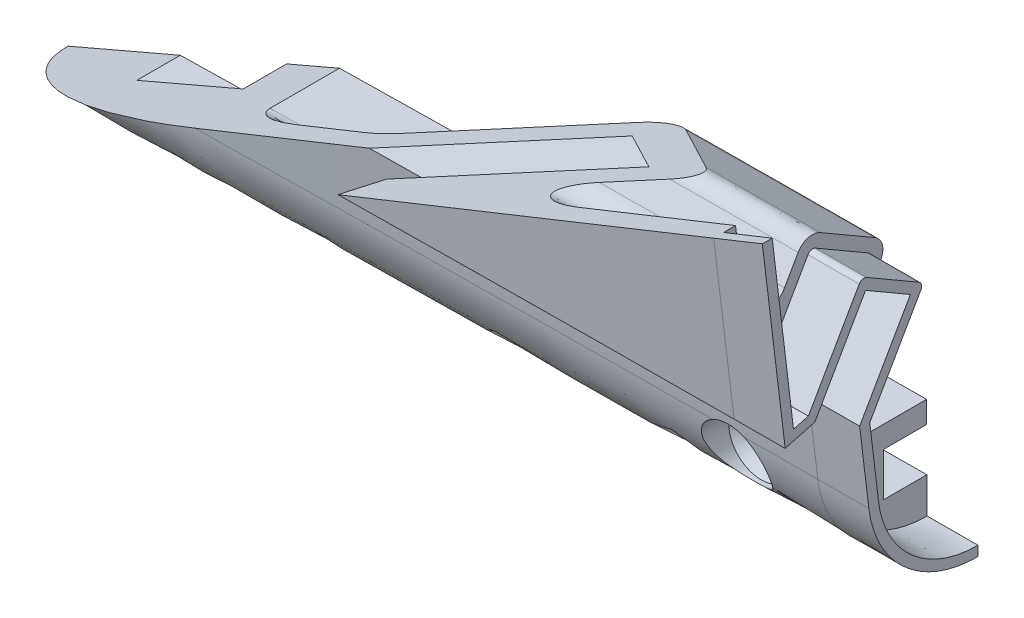
from build123d import *


with BuildPart() as part:
    # Sweep3: sweep along a path in Sketch3
    with BuildLine(Plane.XY.offset(101.6)) as sweep3_path:
        ThreePointArc((622.103936151, -83.199836272), (0, -43.636564626), (-622.103936151, -83.199836272))
    # Sketch4 → Sweep3 (sweep)
    with BuildSketch(Plane(origin=(-117.330566703, 4.430423936, 1117.6), x_dir=(0, 0, -1), z_dir=(0.9994536405585157, 0.03305178322465143, 0))):
        with BuildLine():
            Line((991.529482971, -5.453775083), (988.971801376, -5.453775083))
            Line((988.971801376, -5.453775083), (993.32506615, -42.283775083))
            Line((993.32506615, -42.283775083), (996.794703229, -41.354088728))
            Line((996.794703229, -41.354088728), (1002.763703229, -31.015013775))
            Line((1002.763703229, -31.015013775), (1007.999, -34.037749136))
            Line((1007.999, -34.037749136), (1002.03, -44.376824659))
            Line((1002.03, -44.376824659), (1003.077032208, -53.235049058))
            ThreePointArc((1003.077032208, -53.235049058), (1007.29752688, -61.276835992), (1015.8095, -64.443731312))
            Line((1015.8095, -64.443731312), (1015.8095, -59.12218153))
            Line((1015.8095, -59.12218153), (1010.7295, -59.12218153))
            Line((1010.7295, -59.12218153), (1010.7295, -54.041969025))
            Line((1010.7295, -54.041969025), (1015.8095, -54.041969025))
            Line((1015.8095, -54.041969025), (1015.8095, -51.501969025))
            Line((1015.8095, -51.501969025), (1007.687322123, -51.501969025))
            ThreePointArc((1007.687322123, -51.501969025), (1005.99997215, -50.860507955), (1005.164881483, -49.260118685))
            Line((1005.164881483, -49.260118685), (1004.750455768, -45.75394576))
            ThreePointArc((1004.750455768, -45.75394576), (1004.7850335, -44.943801809), (1005.073167189, -44.18583887))
            Line((1005.073167189, -44.18583887), (1010.516206197, -34.757795418))
            ThreePointArc((1010.516206197, -34.757795418), (1010.706497969, -33.312277166), (1009.818941274, -32.155567572))
            Line((1009.818941274, -32.155567572), (1003.483804566, -28.49781089))
            ThreePointArc((1003.483804566, -28.49781089), (1002.038222268, -28.307482122), (1000.881475684, -29.195102853))
            Line((1000.881475684, -29.195102853), (999.272416391, -31.982200293))
            ThreePointArc((999.272416391, -31.982200293), (996.560692883, -33.200105913), (994.550246564, -31.010392672))
            Line((994.550246564, -31.010392672), (991.529482971, -5.453775083))
        make_face()
    sweep(path=sweep3_path.line)

    # SurfaceCut1
    split(bisect_by=Plane(origin=(-211.442164364, -9.040193423, 0), x_dir=(0.04271589869142412, -0.9990872594518379, 0), z_dir=(-0.9990872594518379, -0.04271589869142412, 0)), keep=Keep.BOTTOM)

    # SurfaceCut2
    split(bisect_by=Plane(origin=(-22.670567211, -0.103737371, 0), x_dir=(-0.004575813400742646, 0.9999895309110599, 0), z_dir=(0.99998953091106, 0.004575813400742646, 0)), keep=Keep.BOTTOM)

    # Sketch8 → Cut-Revolve1 (revolve, cut)
    with BuildSketch(Plane(origin=(-117.056038996, -3.871025798, 0), x_dir=(0, 0, -1), z_dir=(0.9994536405585157, 0.03305178322465143, 0)), mode=Mode.PRIVATE) as cut_revolve1_sk:
        Polygon((-119.5705, -48.27608749), (-106.8705, -48.27608749), (-106.8705, -46.37108749), (-108.7755, -46.37108749), (-110.6805, -44.46608749), (-119.5705, -44.46608749), align=None)
    cut_revolve1 = revolve(cut_revolve1_sk.sketch.rotate(Axis((-115.460428217, -52.120737191, 119.5705), (0, 0, -1)), 91.894072645), axis=Axis((-115.460428217, -52.120737191, 119.5705), (0, 0, -1)), mode=Mode.SUBTRACT)

    # Sketch-Pattern1: Cut-Revolve1 at 2 more places
    with Locations((82.543476, 1.248991, 0), (-82.510753, -2.638363, 0)):
        add(cut_revolve1, mode=Mode.SUBTRACT)

    # Sweep4: sweep along a path in Sketch12
    with BuildLine(Plane(origin=(0, 0, 101.7905), x_dir=(-1, 0, 0), z_dir=(0, 0, -1))) as sweep4_path:
        ThreePointArc((22.461775047, -45.732778631), (19.477278647, -45.720029285), (16.492775047, -45.709094497))
    # Sketch11 → Sweep4 (sweep)
    with BuildSketch(Plane(origin=(-22.670567211, -0.103737371, 0), x_dir=(0, 0, -1), z_dir=(0.9999895309110599, 0.004575813400742645, 0))):
        with BuildLine():
            Line((-127.477241199, 0.416616241), (-123.294888708, -34.965832659))
            Line((-123.294888708, -34.965832659), (-121.558436986, -34.500572786))
            Line((-121.558436986, -34.500572786), (-115.572163807, -24.132043494))
            ThreePointArc((-115.572163807, -24.132043494), (-115.18658777, -23.836180594), (-114.704737676, -23.899617362))
            Line((-114.704737676, -23.899617362), (-108.589559095, -27.430217362))
            ThreePointArc((-108.589559095, -27.430217362), (-108.293696195, -27.8157934), (-108.357132963, -28.297643494))
            Line((-108.357132963, -28.297643494), (-114.390345193, -38.747473608))
            Line((-114.390345193, -38.747473608), (-113.38787021, -47.228347431))
            add(Edge.make_bspline(
                [(-113.38787021, -47.228347431), (-113.304795542, -47.931153716), (-113.005394664, -49.331088938), (-111.931567303, -51.921905104), (-109.715936846, -54.745328052), (-106.035083238, -56.946179963), (-103.201893406, -57.44100982), (-101.801323322, -57.427746915)],
                knots=[0, 0, 0, 0, 0.125, 0.25, 0.5, 0.75, 1, 1, 1, 1], degree=3))
            Line((-101.801323322, -57.427746915), (-101.7905, -57.427746915))
            Line((-101.7905, -57.427746915), (-101.7905, -58.570695669))
            add(Edge.make_bspline(
                [(-114.522967792, -47.362520754), (-114.477136038, -47.750254403), (-114.413580033, -48.134868747), (-114.251122313, -48.897876915), (-114.152305696, -49.275250489), (-113.807619255, -50.383084428), (-113.512952594, -51.094253598), (-112.794349261, -52.462021573), (-112.366195112, -53.121992394), (-111.411403795, -54.334514945), (-110.882225451, -54.893793968), (-110.009875034, -55.661414508), (-109.70425095, -55.906443165), (-109.076570448, -56.363840109), (-108.75418736, -56.576773283), (-107.762018779, -57.169401136), (-107.067422067, -57.503308187), (-105.974437358, -57.909885857), (-105.601773783, -58.029259911), (-104.85459633, -58.231444087), (-104.478193263, -58.315009286), (-103.340677537, -58.513974287), (-102.571330027, -58.578089855), (-101.7905, -58.570695669)],
                knots=[0, 0, 0, 0, 0.0625, 0.0625, 0.125, 0.125, 0.25, 0.25, 0.375, 0.375, 0.5, 0.5, 0.5625, 0.5625, 0.625, 0.625, 0.75, 0.75, 0.8125, 0.8125, 0.875, 0.875, 1, 1, 1, 1], degree=3))
            Line((-114.522967792, -47.362520754), (-115.57, -38.504695669))
            Line((-115.57, -38.504695669), (-109.601, -28.166084399))
            Line((-109.601, -28.166084399), (-114.836296771, -25.143484399))
            Line((-114.836296771, -25.143484399), (-120.805296771, -35.482095669))
            Line((-120.805296771, -35.482095669), (-124.27493385, -36.411740234))
            Line((-124.27493385, -36.411740234), (-128.628198624, 0.416616241))
            Line((-128.628198624, 0.416616241), (-127.477241199, 0.416616241))
        make_face()
    sweep(path=sweep4_path.line)

    # Sweep5: sweep along a path in Sketch16
    with BuildLine(Plane(origin=(0, 0, 101.7905), x_dir=(-1, 0, 0), z_dir=(0, 0, -1))) as sweep5_path:
        ThreePointArc((215.647406705, -50.42045008), (212.665748146, -50.290245196), (209.684010975, -50.161853153))
    # Sketch15 → Sweep5 (sweep)
    with BuildSketch(Plane(origin=(-211.442164364, -9.040193423, 0), x_dir=(0, 0, 1), z_dir=(-0.9990872594518379, -0.04271589869142412, 0))):
        with BuildLine():
            Line((113.00950435, -42.713331456), (113.97237291, -34.567525415))
            ThreePointArc((113.97237291, -34.567525415), (113.963727961, -34.364981701), (113.891689273, -34.175484686))
            Line((113.891689273, -34.175484686), (107.519177285, -23.137970149))
            Line((107.519177285, -23.137970149), (115.394119486, -18.591370149))
            Line((115.394119486, -18.591370149), (121.677968823, -29.475316467))
            ThreePointArc((121.677968823, -29.475316467), (121.841334284, -29.661598015), (122.06355177, -29.771181218))
            Line((122.06355177, -29.771181218), (122.259394286, -29.823654698))
            ThreePointArc((122.259394286, -29.823654698), (122.780015415, -29.735923875), (123.054347243, -29.284830643))
            Line((123.054347243, -29.284830643), (127.093588723, 4.886907775))
            Line((127.093588723, 4.886907775), (126.070517029, 4.886907775))
            Line((126.070517029, 4.886907775), (123.049753436, -20.668571968))
            add(Edge.make_bspline(
                [(123.049753436, -20.668571968), (123.018406598, -20.933764287), (122.944898871, -21.192703381), (122.72486191, -21.671025374), (122.574983618, -21.89613649), (122.218479429, -22.283693321), (122.006878086, -22.451668909), (121.662818096, -22.646204147), (121.543504304, -22.701961436), (121.295473201, -22.795007288), (121.166493424, -22.832124521), (120.907997451, -22.885096572), (120.777385583, -22.901432856), (120.51342226, -22.913717924), (120.37910716, -22.909438417), (120.116311005, -22.880334184), (119.986998098, -22.855691982), (119.732512188, -22.786374688), (119.606266969, -22.741161694), (119.243601748, -22.578043456), (119.021351761, -22.432970621), (118.626712377, -22.076251458), (118.461102845, -21.871598209), (118.327583609, -21.640336089)],
                knots=[0, 0, 0, 0, 0.125, 0.125, 0.25, 0.25, 0.375, 0.375, 0.4375, 0.4375, 0.5, 0.5, 0.5625, 0.5625, 0.625, 0.625, 0.6875, 0.6875, 0.75, 0.75, 0.875, 0.875, 1, 1, 1, 1], degree=3))
            Line((118.327583609, -21.640336089), (116.718524316, -18.853363359))
            ThreePointArc((116.718524316, -18.853363359), (115.561765682, -17.965779092), (114.116195434, -18.156102576))
            Line((114.116195434, -18.156102576), (107.781058726, -21.813695606))
            ThreePointArc((107.781058726, -21.813695606), (106.893505265, -22.97034131), (107.083793803, -24.415806877))
            Line((107.083793803, -24.415806877), (112.526832811, -33.84342694))
            ThreePointArc((112.526832811, -33.84342694), (112.814966033, -34.601353512), (112.849544232, -35.411463252))
            Line((112.849544232, -35.411463252), (112.435118517, -38.917478209))
            ThreePointArc((112.435118517, -38.917478209), (111.600006373, -40.51781438), (109.912677877, -41.159227425))
            Line((109.912677877, -41.159227425), (101.7905, -41.159227425))
            Line((101.7905, -41.159227425), (101.7905, -43.699112741))
            Line((101.7905, -43.699112741), (106.8705, -43.699112741))
            Line((106.8705, -43.699112741), (106.8705, -48.779095512))
            Line((106.8705, -48.779095512), (101.7905, -48.779095512))
            Line((101.7905, -48.779095512), (101.7905, -52.576472462))
            Line((101.7905, -52.576472462), (101.804931097, -52.576472462))
            add(Edge.make_bspline(
                [(101.804931097, -52.576472462), (102.489279498, -52.582953001), (103.868868527, -52.467414443), (106.485766193, -51.75509811), (109.465837716, -49.976138537), (112.028433947, -46.715360308), (112.850511097, -44.058404026), (113.00950435, -42.713331456)],
                knots=[0, 0, 0, 0, 0.125, 0.25, 0.5, 0.75, 1, 1, 1, 1], degree=3))
        make_face()
    sweep(path=sweep5_path.line)

    # SurfaceCut3
    split(bisect_by=Plane(origin=(2.672551109, -6.221367781, 0), x_dir=(-0.9188104615967029, -0.3946990444128967, 0), z_dir=(0.3946990444128967, -0.9188104615967029, 0)), keep=Keep.TOP)


solid = part.part
